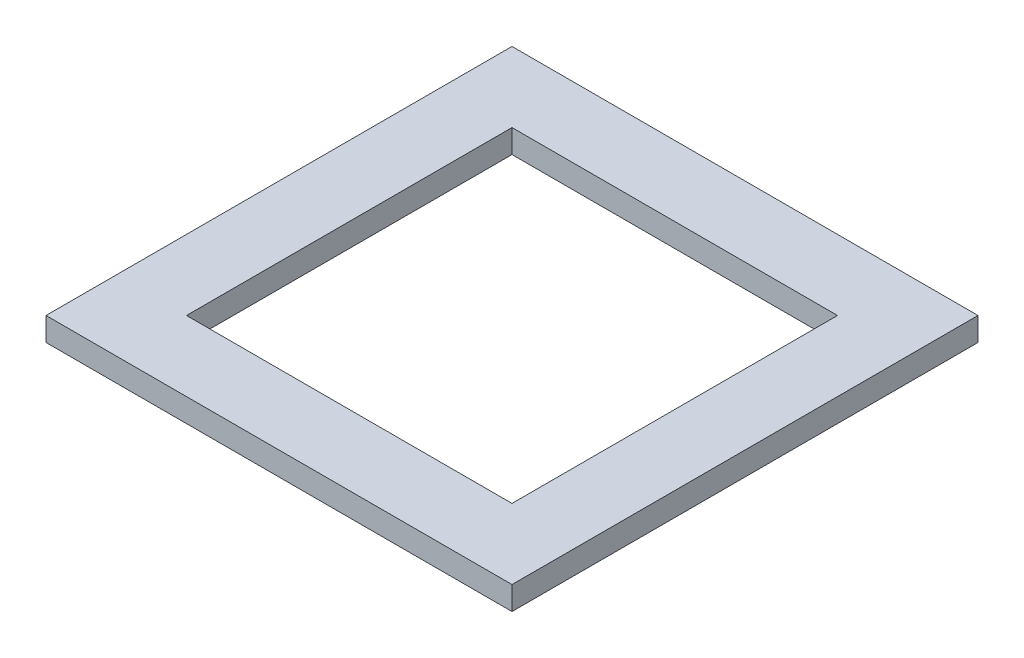
from build123d import *

# Parameters (mm, degrees)
SKETCH_4_W      = 19.9
SKETCH_4_H      = 19.9
SKETCH_4_W_2    = 13.9
SKETCH_4_H_2    = 13.9
EXTRUDE_1_DEPTH = 1


with BuildPart() as part:
    # 草图4 → 凸台-拉伸1 (new body)
    with BuildSketch(Plane(origin=(0, 0, 0), x_dir=(1, 0, 0), z_dir=(0, 1, 0))):
        Rectangle(SKETCH_4_W, SKETCH_4_H)
        Rectangle(SKETCH_4_W_2, SKETCH_4_H_2, mode=Mode.SUBTRACT)
    extrude(amount=EXTRUDE_1_DEPTH)


solid = part.part
